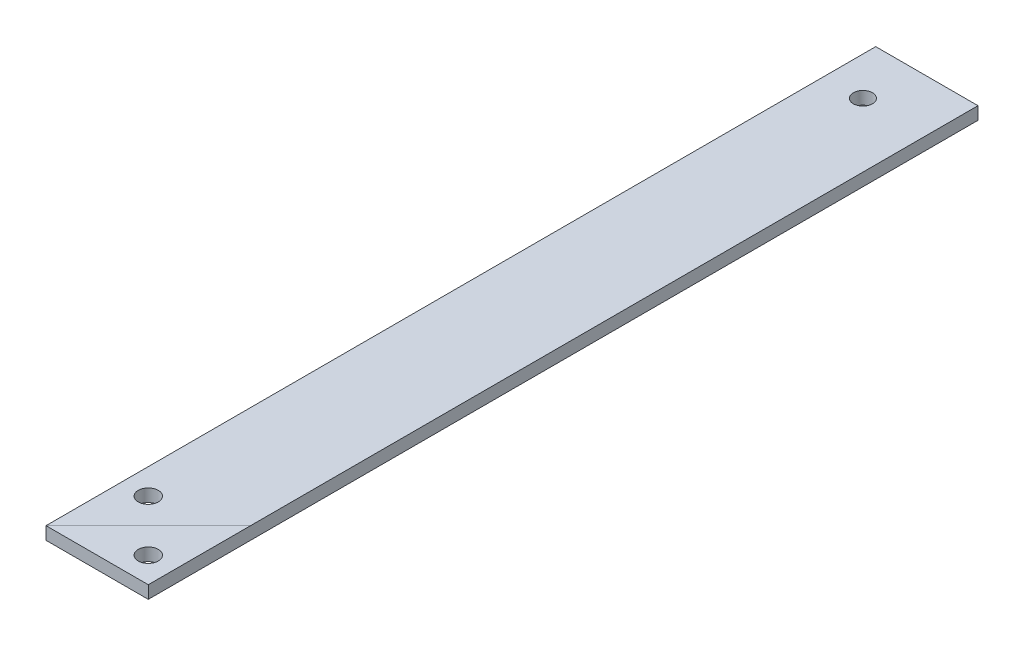
from build123d import *

# Parameters (mm, degrees)
CROQUIS1_W              = 50.8
CROQUIS1_H              = 303.74
SALIENTE_EXTRUIR1_DEPTH = 6.31
CROQUIS3_W              = 50.8
CROQUIS3_H              = 6.31
CROQUIS4_W              = 6.31
CROQUIS4_H              = 50.8
SALIENTE_EXTRUIR2_DEPTH = 60
CROQUIS6_W              = 6.31
CROQUIS6_H              = 50.8
SALIENTE_EXTRUIR3_DEPTH = 50
CROQUIS8_R              = 6.35
CORTAR_EXTRUIR2_DEPTH   = 10
CROQUIS9_W              = 6.31
CROQUIS9_H              = 50.8
SALIENTE_EXTRUIR4_DEPTH = 50.8
CROQUIS11_W             = 50.8
CROQUIS11_H             = 50
CORTAR_EXTRUIR3_DEPTH   = 10
CORTAR_EXTRUIR4_DEPTH   = 97.8
CROQUIS13_R             = 4.7625
CORTAR_EXTRUIR5_DEPTH   = 9.525
CROQUIS14_R             = 5
CORTAR_EXTRUIR6_DEPTH   = 9.525


with BuildPart() as part:
    # Croquis1 → Saliente-Extruir1 (new body)
    with BuildSketch(Plane(origin=(0, 0, 0), x_dir=(1, 0, 0), z_dir=(0, 1, 0))):
        Rectangle(CROQUIS1_W, CROQUIS1_H)
    extrude(amount=SALIENTE_EXTRUIR1_DEPTH)

    # Barrer1: sweep along a curve in space
    with BuildLine() as barrer1_path:
        Line((0, 3.155, 151.87), (0, 3.155, 234.825660606))
        Line((0, 3.155, 234.825660606), (306, 3.155, 234.825660606))
    # Croquis3 → Barrer1 (sweep)
    with BuildSketch(Plane.XY.offset(151.87)):
        with Locations((0, 3.155)):
            Rectangle(CROQUIS3_W, CROQUIS3_H)
    sweep(path=barrer1_path.line, transition=Transition.RIGHT)

    # Croquis4 → Saliente-Extruir2 (add)
    with BuildSketch(Plane.XZ):
        with Locations((302.845, 234.825660606)):
            Rectangle(CROQUIS4_W, CROQUIS4_H)
    extrude(amount=SALIENTE_EXTRUIR2_DEPTH)

    # Croquis6 → Saliente-Extruir3 (add)
    with BuildSketch(Plane(origin=(0, 6.31, 0), x_dir=(1, 0, 0), z_dir=(0, 1, 0))):
        with Locations((22.245, 126.47)):
            Rectangle(CROQUIS6_W, CROQUIS6_H)
    extrude(amount=SALIENTE_EXTRUIR3_DEPTH)

    # Croquis8 → Cortar-Extruir2 (cut)
    with BuildSketch(Plane.ZY.offset(-19.09)):
        with Locations((-111.12, 29)):
            Circle(CROQUIS8_R)
        with Locations((-143.12, 29)):
            Circle(CROQUIS8_R)
    extrude(amount=-CORTAR_EXTRUIR2_DEPTH, mode=Mode.SUBTRACT)

    # Croquis9 → Saliente-Extruir4 (add)
    with BuildSketch(Plane(origin=(306, 0, 0), x_dir=(0, 0, -1), z_dir=(1, 0, 0))):
        with Locations((-257.070660606, -34.6)):
            Rectangle(CROQUIS9_W, CROQUIS9_H)
    extrude(amount=SALIENTE_EXTRUIR4_DEPTH)

    # Croquis11 → Cortar-Extruir3 (cut)
    with BuildSketch(Plane.ZY.offset(-19.09)):
        with Locations((-126.47, 31.31)):
            Rectangle(CROQUIS11_W, CROQUIS11_H)
    extrude(amount=-CORTAR_EXTRUIR3_DEPTH, mode=Mode.SUBTRACT)

    # Croquis12 → Cortar-Extruir4 (cut)
    with BuildSketch(Plane(origin=(0, 6.31, 0), x_dir=(1, 0, 0), z_dir=(0, 1, 0))):
        Polygon((25.4, -209.425660606), (25.4, -260.225660606), (306, -260.225660606), (366.929604584, -260.225660606), (366.929604584, -209.425660606), align=None)
    extrude(amount=-CORTAR_EXTRUIR4_DEPTH, mode=Mode.SUBTRACT)

    # Croquis13 → Cortar-Extruir5 (cut)
    with BuildSketch(Plane(origin=(0, 6.31, 0), x_dir=(1, 0, 0), z_dir=(0, 1, 0))):
        with Locations(Location((-6.36, 126.47, 0), (0, 0, 270))):
            Circle(CROQUIS13_R)
    extrude(amount=-CORTAR_EXTRUIR5_DEPTH, mode=Mode.SUBTRACT)

    # Croquis14 → Cortar-Extruir6 (cut)
    with BuildSketch(Plane(origin=(0, 6.31, 0), x_dir=(1, 0, 0), z_dir=(0, 1, 0))):
        with Locations(Location((12.7, -247.525660606, 0), (0, 0, 270))):
            Circle(CROQUIS14_R)
        with Locations(Location((-12.7, -222.125660606, 0), (0, 0, 270))):
            Circle(CROQUIS14_R)
    extrude(amount=-CORTAR_EXTRUIR6_DEPTH, mode=Mode.SUBTRACT)


solid = part.part
